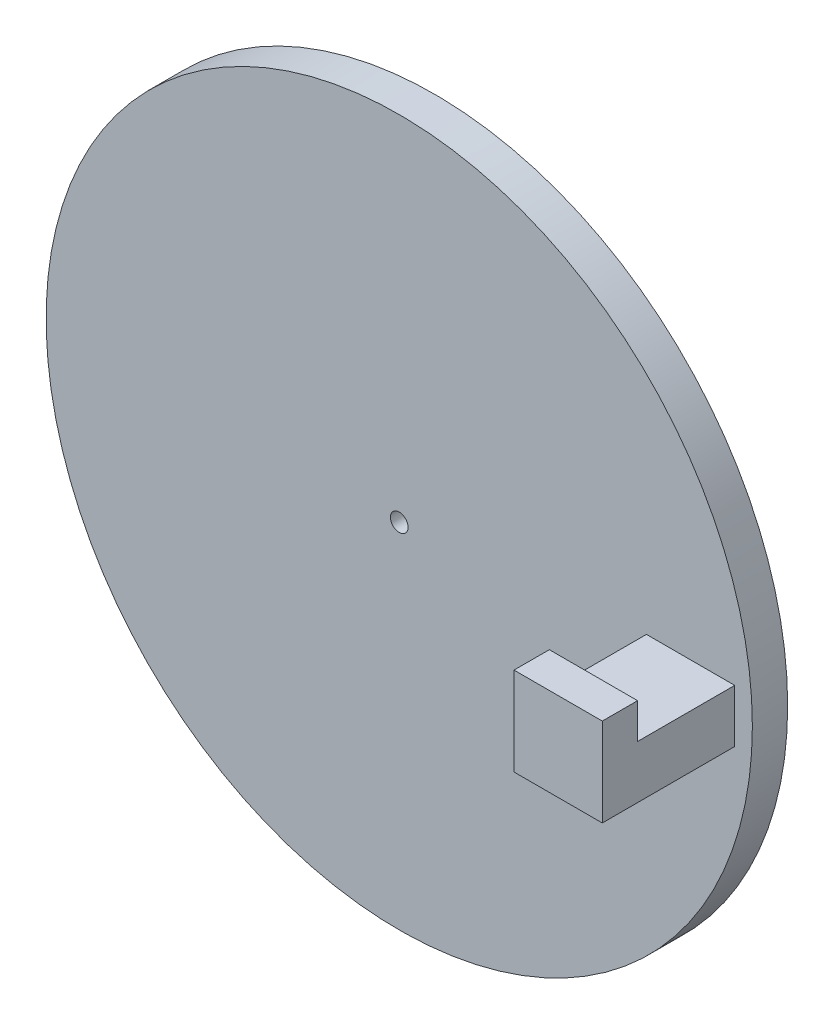
from build123d import *

# Parameters (mm, degrees)
SKETCH1_R           = 50.8
SKETCH1_R_2         = 1.27
BOSS_EXTRUDE1_DEPTH = 5.08
SKETCH2_W           = 12.7
SKETCH2_H           = 7.62
BOSS_EXTRUDE2_DEPTH = 19.05
SKETCH3_W           = 12.7
SKETCH3_H           = 5.08
BOSS_EXTRUDE3_DEPTH = 5.08


with BuildPart() as part:
    # Sketch1 → Boss-Extrude1 (new body)
    with BuildSketch(Plane.XY):
        Circle(SKETCH1_R)
        Circle(SKETCH1_R_2, mode=Mode.SUBTRACT)
    extrude(amount=BOSS_EXTRUDE1_DEPTH)

    # Sketch2 → Boss-Extrude2 (add)
    with BuildSketch(Plane.XY.offset(5.08)):
        with Locations((41.91, 0)):
            Rectangle(SKETCH2_W, SKETCH2_H)
    extrude(amount=BOSS_EXTRUDE2_DEPTH)

    # Sketch3 → Boss-Extrude3 (add)
    with BuildSketch(Plane(origin=(0, 3.81, 0), x_dir=(1, 0, 0), z_dir=(0, 1, 0))):
        with Locations((41.91, -21.59)):
            Rectangle(SKETCH3_W, SKETCH3_H)
    extrude(amount=BOSS_EXTRUDE3_DEPTH)


solid = part.part
